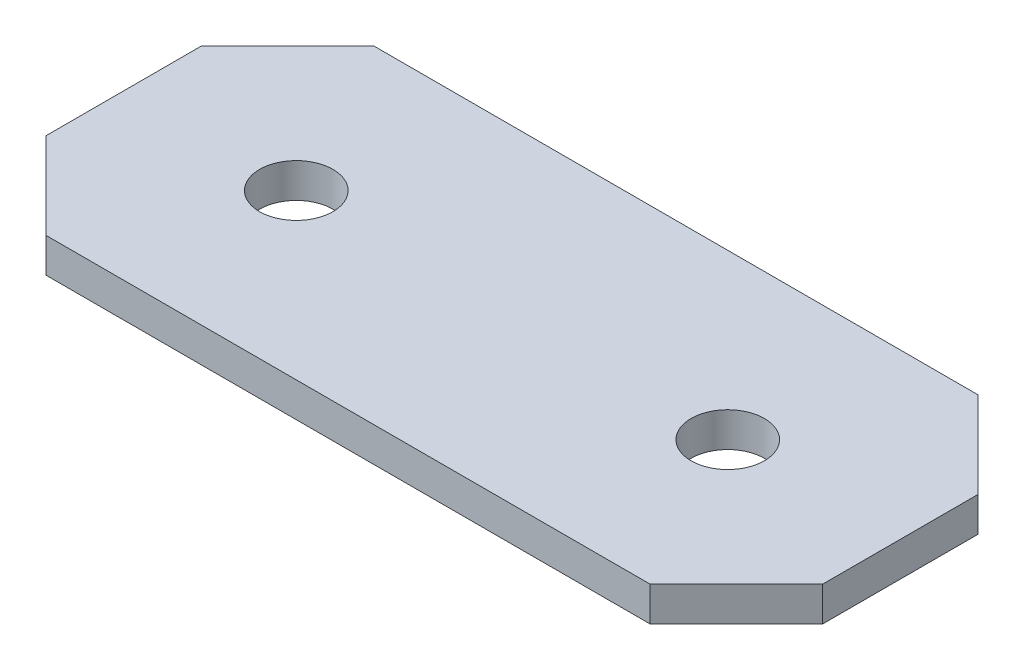
from build123d import *

# Parameters (mm, degrees)
SZKIC1_R                    = 4.25
DODANIE_WYCI_GNI_CIE1_DEPTH = 4


with BuildPart() as part:
    # Szkic1 → Dodanie-wyciągnięcie1 (new body)
    with BuildSketch(Plane(origin=(0, 0, 0), x_dir=(1, 0, 0), z_dir=(0, 1, 0))):
        Polygon((45, -9), (45, 9), (35, 19), (-35, 19), (-45, 9), (-45, -9), (-35, -19), (35, -19), align=None)
        with Locations(Location((25, 0, 0), (0, 0, 270))):
            Circle(SZKIC1_R, mode=Mode.SUBTRACT)
        with Locations(Location((-25, 0, 0), (0, 0, 270))):
            Circle(SZKIC1_R, mode=Mode.SUBTRACT)
    extrude(amount=DODANIE_WYCI_GNI_CIE1_DEPTH)


solid = part.part
